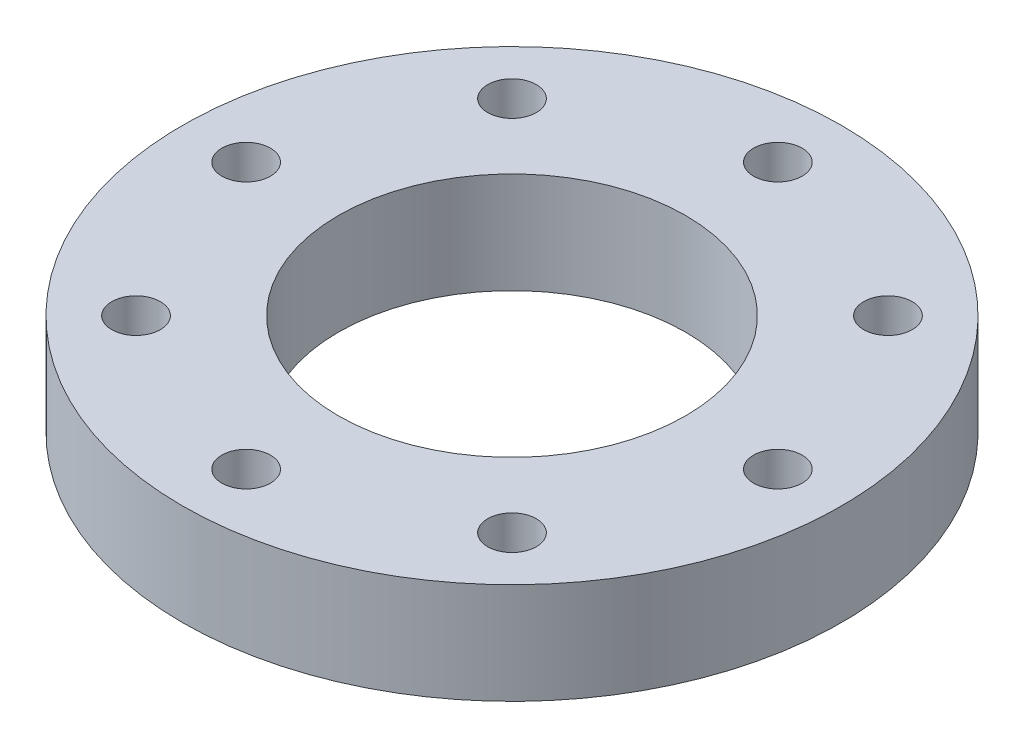
from build123d import *

# Parameters (mm, degrees)
SKETCH1_R           = 57.15
SKETCH1_R_2         = 30.099
EXTRUDE_THIN1_DEPTH = 17.526
SKETCH2_R           = 4.2164
CUT_EXTRUDE2_DEPTH  = 17.526
CIRPATTERN1_COUNT   = 8


with BuildPart() as part:
    # Sketch1 → Extrude-Thin1 (new body)
    with BuildSketch(Plane(origin=(0, 0, 0), x_dir=(1, 0, 0), z_dir=(0, 1, 0))):
        Circle(SKETCH1_R)
        Circle(SKETCH1_R_2, mode=Mode.SUBTRACT)
    extrude(amount=EXTRUDE_THIN1_DEPTH)

    # Sketch2 → Cut-Extrude2 (cut)
    with BuildSketch(Plane(origin=(0, 0, 0), x_dir=(1, 0, 0), z_dir=(0, 1, 0))):
        with Locations(Location((0, 46.101, 0), (0, 0, 270))):
            Circle(SKETCH2_R)
    cut_extrude2 = extrude(amount=CUT_EXTRUDE2_DEPTH, mode=Mode.SUBTRACT)

    # CirPattern1: Cut-Extrude2 ×8 about axis
    cirpattern1_axis = Axis((0, 0, 0), (0, 1, 0))
    for i in range(1, CIRPATTERN1_COUNT):
        add(cut_extrude2.rotate(cirpattern1_axis, i * 360 / CIRPATTERN1_COUNT), mode=Mode.SUBTRACT)


solid = part.part
